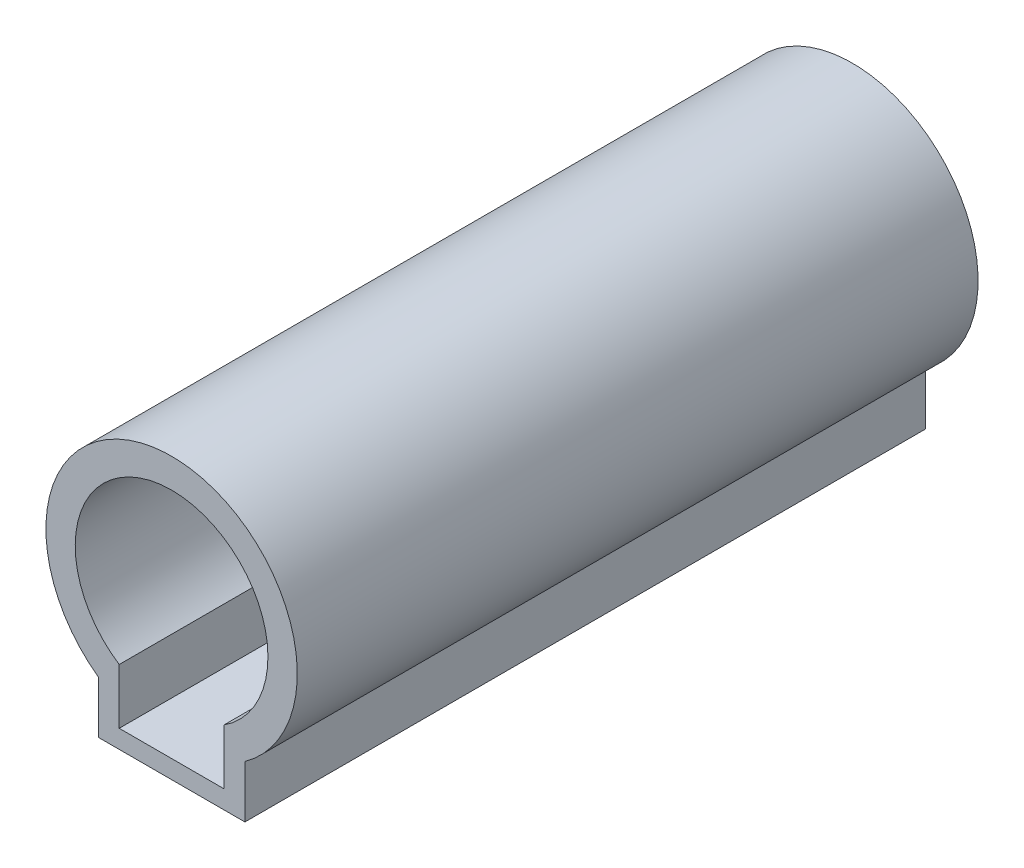
from build123d import *

# Parameters (mm, degrees)
SKETCH1_R           = 9.2
BOSS_EXTRUDE1_DEPTH = 65
SKETCH2_W           = 10
SKETCH2_H           = 12.398416249
CUT_EXTRUDE3_DEPTH  = 68.723466712


with BuildPart() as part:
    # Sketch1 → Boss-Extrude1 (new body)
    with BuildSketch(Plane.XY):
        with BuildLine():
            Line((-7, -9.746794345), (-7, -14.746794345))
            Line((-7, -14.746794345), (7, -14.746794345))
            Line((7, -14.746794345), (7, -9.746794345))
            ThreePointArc((7, -9.746794345), (0, 12), (-7, -9.746794345))
        make_face()
        Circle(SKETCH1_R, mode=Mode.SUBTRACT)
    extrude(amount=BOSS_EXTRUDE1_DEPTH)

    # Sketch2 → Cut-Extrude3 (cut, through all)
    with BuildSketch(Plane.XY):
        with Locations((0, -6.800791875)):
            Rectangle(SKETCH2_W, SKETCH2_H)
    extrude(amount=CUT_EXTRUDE3_DEPTH, mode=Mode.SUBTRACT)


solid = part.part
